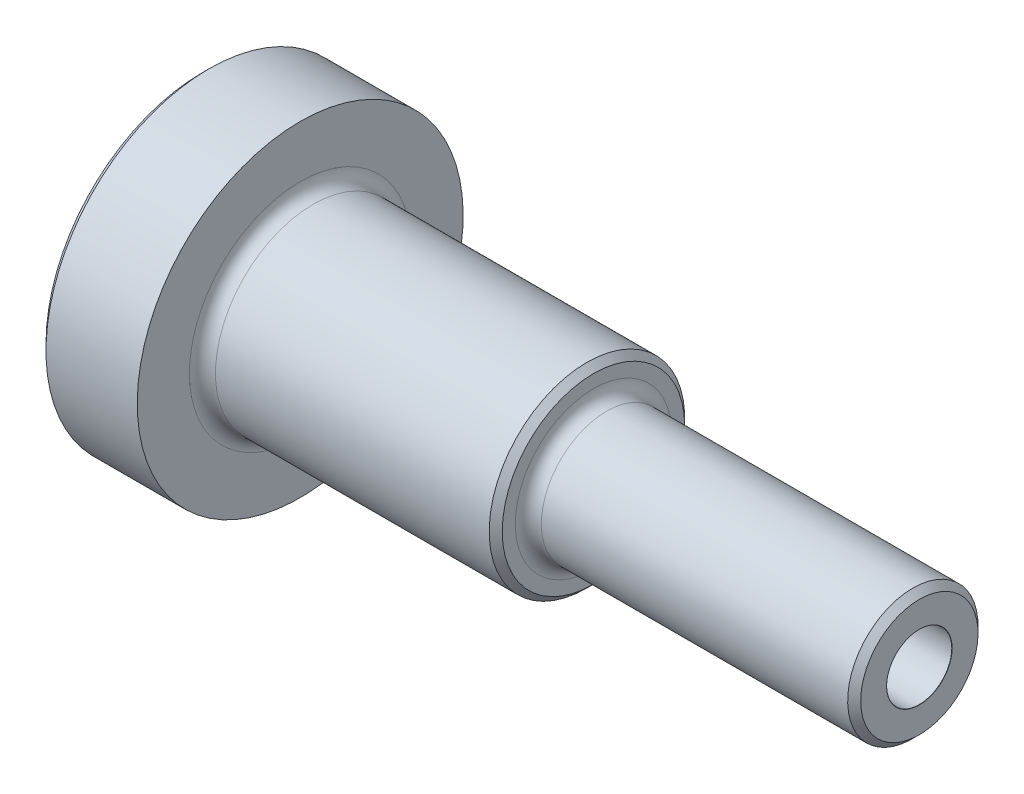
from build123d import *

# Parameters (mm, degrees)
FUROS_GUIA_COM_10_0MM1_D           = 10
FUROS_GUIA_COM_10_0MM1_CSINK_D     = 10.05
FUROS_GUIA_COM_10_0MM1_CSINK_ANGLE = 90
FILETE1_R                          = 2
CHANFRO4_SIZE                      = 1
CHANFRO6_SIZE                      = 1


with BuildPart() as part:
    # Esboço1 → Revolução1 (revolve)
    with BuildSketch(Plane.XY):
        Polygon((0, 0), (0, 25), (15, 25), (15, 15), (60, 15), (60, 10), (110, 10), (110, 0), align=None)
    revolve(axis=Axis((110, 0, 0), (-1, 0, 0)))

    # Furos-guia com Ø10.0mm1 (through all)
    with Locations(Plane(origin=(110, 0, 0), x_dir=(0, 0, -1), z_dir=(1, 0, 0))):
        with Locations((0, 0)):
            CounterSinkHole(FUROS_GUIA_COM_10_0MM1_D / 2, FUROS_GUIA_COM_10_0MM1_CSINK_D / 2, counter_sink_angle=FUROS_GUIA_COM_10_0MM1_CSINK_ANGLE)

    # Filete1
    filete1_edges = [part.edges().sort_by_distance(p)[0] for p in [
        (60, -10, 0),
        (15, -15, 0),
    ]]
    fillet(filete1_edges, radius=FILETE1_R)

    # Chanfro4
    chanfro4_edges = [part.edges().sort_by_distance(p)[0] for p in [
        (110, -10, 0),
        (60, -15, 0),
        (0, -25, 0),
    ]]
    chamfer(chanfro4_edges, length=CHANFRO4_SIZE)

    # Chanfro6
    chanfro6_edges = [part.edges().sort_by_distance(p)[0] for p in [
        (0, 0, -5),
    ]]
    chamfer(chanfro6_edges, length=CHANFRO6_SIZE)


solid = part.part
